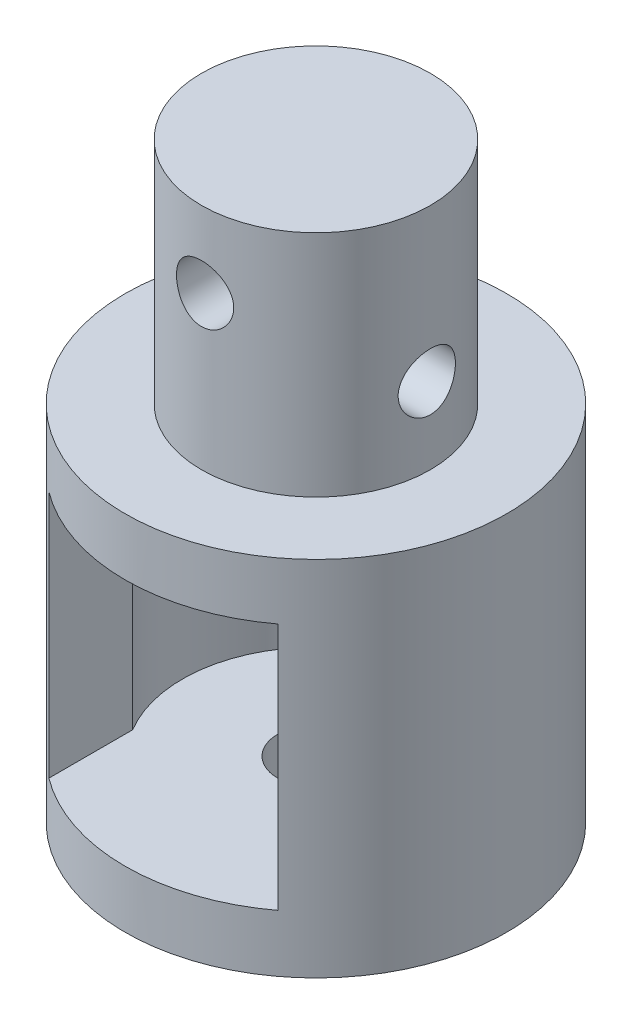
from build123d import *

# Parameters (mm, degrees)
SKETCH_2_R               = 7
CUT_EXTRUDE_1_DEPTH      = 13
CUT_EXTRUDE_2_DEPTH      = 18
CUT_EXTRUDE_3_DEPTH      = 35.073450075
CUT_EXTRUDE_3_DEPTH_BACK = 35.073450075
SKETCH_4_R               = 1.5
SKETCH_5_R               = 2
CUT_EXTRUDE_4_DEPTH      = 4
CUT_EXTRUDE_5_DEPTH      = 35.073450166
CUT_EXTRUDE_5_DEPTH_BACK = 35.073450166
SKETCH_6_R               = 1.5


with BuildPart() as part:
    # 草图1 → 旋转1 (revolve)
    with BuildSketch(Plane.XY, mode=Mode.PRIVATE) as revolve_1_sk:
        Polygon((0, 0), (10, 0), (10, 19), (6, 19), (6, 31), (0, 31), align=None)
    revolve(revolve_1_sk.sketch.rotate(Axis((0, 31, 0), (0, -1, 0)), 180), axis=Axis((0, 31, 0), (0, -1, 0)))

    # 草图2 → 切除-拉伸1 (cut)
    with BuildSketch(Plane(origin=(0, 3, 0), x_dir=(1, 0, 0), z_dir=(0, 1, 0))):
        with Locations(Location((0, 0, 0), (0, 0, 90))):
            Circle(SKETCH_2_R)
    extrude(amount=CUT_EXTRUDE_1_DEPTH, mode=Mode.SUBTRACT)

    # 草图3 → 切除-拉伸2 (cut)
    with BuildSketch(Plane.XY):
        Polygon((0, 3), (6, 3), (6, 16), (-6, 16), (-6, 3), align=None)
    extrude(amount=CUT_EXTRUDE_2_DEPTH, mode=Mode.SUBTRACT)

    # 草图4 → 切除-拉伸3 (cut, two sides: drawn at the far end of the back side and taken through both)
    with BuildSketch(Plane.XY.offset(-CUT_EXTRUDE_3_DEPTH_BACK)):
        with Locations((0, 27)):
            Circle(SKETCH_4_R)
    extrude(amount=CUT_EXTRUDE_3_DEPTH + CUT_EXTRUDE_3_DEPTH_BACK, mode=Mode.SUBTRACT)

    # 草图5 → 切除-拉伸4 (cut)
    with BuildSketch(Plane.XZ):
        with Locations(Location((0, 0, 0), (0, 0, 270))):
            Circle(SKETCH_5_R)
    extrude(amount=-CUT_EXTRUDE_4_DEPTH, mode=Mode.SUBTRACT)

    # 草图6 → 切除-拉伸5 (cut, two sides: drawn at the far end of the back side and taken through both)
    with BuildSketch(Plane(origin=(0, 0, 0), x_dir=(0, 0, -1), z_dir=(1, 0, 0)).offset(-CUT_EXTRUDE_5_DEPTH_BACK)):
        with Locations((0, 23)):
            Circle(SKETCH_6_R)
    extrude(amount=CUT_EXTRUDE_5_DEPTH + CUT_EXTRUDE_5_DEPTH_BACK, mode=Mode.SUBTRACT)


solid = part.part
